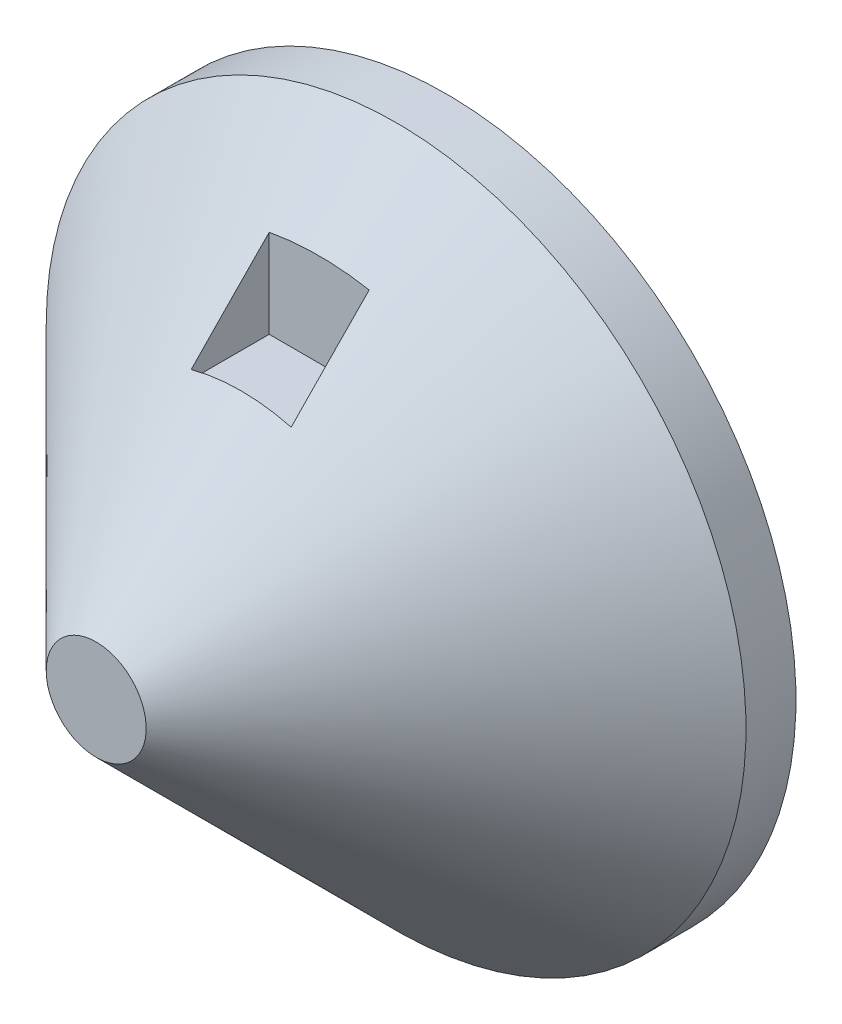
from build123d import *

# Parameters (mm, degrees)
CUT_EXTRUDE1_START = 38.1
SKETCH4_W          = 12.7
SKETCH4_H          = 9.906
CUT_EXTRUDE1_DEPTH = 15.24


with BuildPart() as part:
    # Sketch2 → Revolve2 (revolve)
    with BuildSketch(Plane(origin=(0, 0, 0), x_dir=(0, 0, -1), z_dir=(1, 0, 0)), mode=Mode.PRIVATE) as revolve2_sk:
        Polygon((0, 0), (0, 6.35), (38.1, 44.45), (44.45, 44.45), (44.45, 38.1), (6.35, 0), align=None)
    revolve(revolve2_sk.sketch.rotate(Axis((0, 0, -6.35), (0, 0, 1)), 90), axis=Axis((0, 0, -6.35), (0, 0, 1)))

    # Sketch4 → Cut-Extrude1 (cut)
    with BuildSketch(Plane(origin=(0, 0, 0), x_dir=(1, 0, 0), z_dir=(0, 1, 0)).offset(CUT_EXTRUDE1_START)):
        with Locations((0, 23.373056835)):
            Rectangle(SKETCH4_W, SKETCH4_H)
    extrude(amount=-CUT_EXTRUDE1_DEPTH, mode=Mode.SUBTRACT)


solid = part.part
